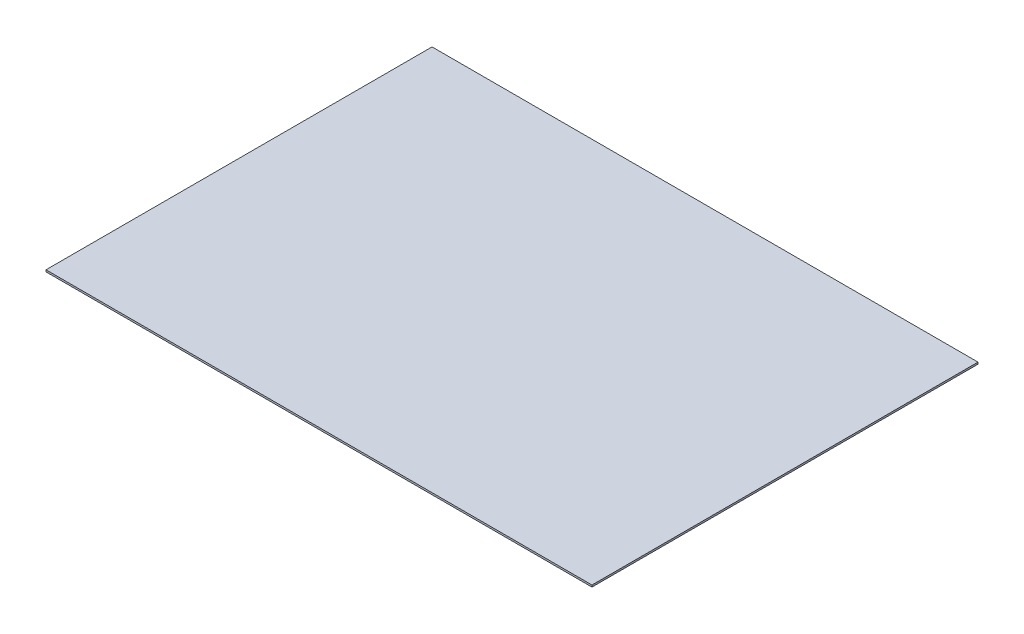
from build123d import *

# Parameters (mm, degrees)
SKETCH1_W           = 297
SKETCH1_H           = 210
BOSS_EXTRUDE1_DEPTH = 1


with BuildPart() as part:
    # Sketch1 → Boss-Extrude1 (new body)
    with BuildSketch(Plane(origin=(0, 0, 0), x_dir=(1, 0, 0), z_dir=(0, 1, 0))):
        with Locations((148.5, 105)):
            Rectangle(SKETCH1_W, SKETCH1_H)
    extrude(amount=BOSS_EXTRUDE1_DEPTH)


solid = part.part
